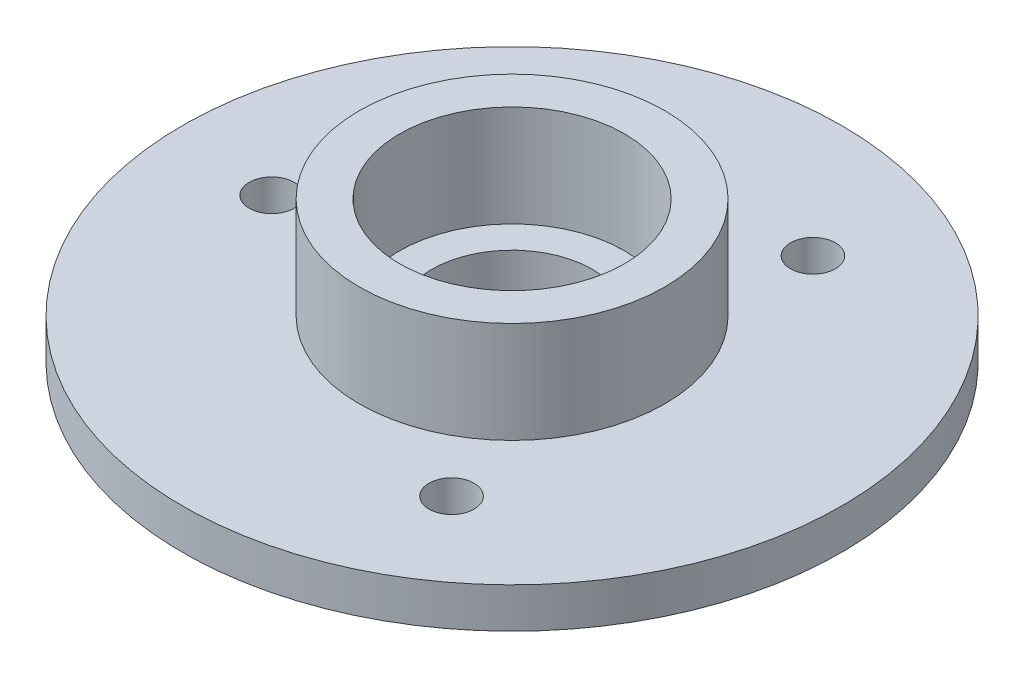
from build123d import *

# Parameters (mm, degrees)
ESQUISSE1_W      = 15.5
ESQUISSE1_H      = 2.5
ESQUISSE1_W_2    = 2.5
ESQUISSE1_H_2    = 6.3
ESQUISSE2_R      = 1.4
EXTRUSION1_DEPTH = 10


with BuildPart() as part:
    # Esquisse1 → Révolution1 (revolve)
    with BuildSketch(Plane.XY, mode=Mode.PRIVATE) as r_volution1_sk:
        with Locations((12.75, 1.25)):
            Rectangle(ESQUISSE1_W, ESQUISSE1_H)
        with Locations((8.25, 5.65)):
            Rectangle(ESQUISSE1_W_2, ESQUISSE1_H_2)
    revolve(r_volution1_sk.sketch.rotate(Axis((0, 0, 0), (0, 1, 0)), 90), axis=Axis((0, 0, 0), (0, 1, 0)))

    # Esquisse2 → Extrusion1 (cut)
    with BuildSketch(Plane.XZ):
        with Locations(Location((-13.965223749, 0.986167141, 0), (0, 0, 270))):
            Circle(ESQUISSE2_R)
        with Locations(Location((7.836657671, 11.601154966, 0), (0, 0, 270))):
            Circle(ESQUISSE2_R)
        with Locations(Location((6.128566078, -12.587322107, 0), (0, 0, 270))):
            Circle(ESQUISSE2_R)
    extrude(amount=-EXTRUSION1_DEPTH, mode=Mode.SUBTRACT)


solid = part.part
